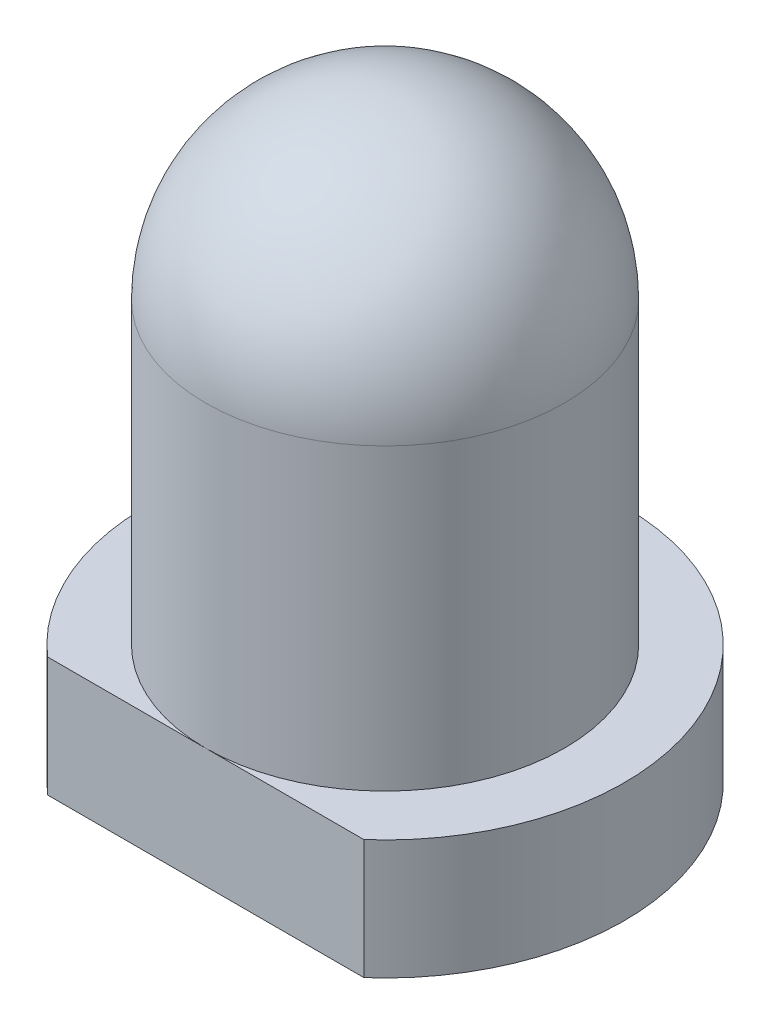
from build123d import *

# Parameters (mm, degrees)
SKETCH1_R     = 1.5
BASE_DEPTH    = 5
DOME_R        = 1.5
BASECUT_DEPTH = 1


with BuildPart() as part:
    # Sketch1 → Base (new body)
    with BuildSketch(Plane(origin=(0, 0, 0), x_dir=(1, 0, 0), z_dir=(0, 1, 0))):
        with Locations(Location((0, 0, 0), (0, 0, 270))):
            Circle(SKETCH1_R)
    extrude(amount=BASE_DEPTH)

    # Dome
    dome_edges = [part.edges().sort_by_distance(p)[0] for p in [
        (0, 5, -1.5),
    ]]
    fillet(dome_edges, radius=DOME_R)

    # BaseCutSketch → BaseCut (add)
    with BuildSketch(Plane(origin=(0, 0, 0), x_dir=(1, 0, 0), z_dir=(0, 1, 0))):
        with BuildLine():
            Line((1.322875656, -1.5), (-1.322875656, -1.5))
            ThreePointArc((-1.322875656, -1.5), (0, 2), (1.322875656, -1.5))
        make_face()
    extrude(amount=BASECUT_DEPTH)


solid = part.part
